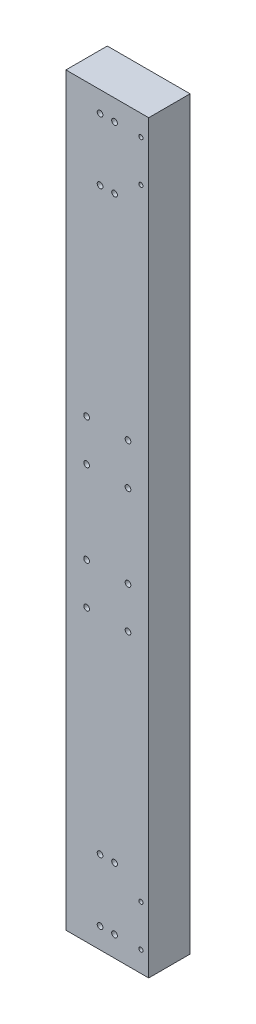
from build123d import *

# Parameters (mm, degrees)
SKETCH1_W           = 101.6
SKETCH1_H           = 50.8
BOSS_EXTRUDE1_DEPTH = 914.4
SKETCH3_R           = 3.4925
CUT_EXTRUDE1_DEPTH  = 50.8
SKETCH4_R           = 2.5527
CUT_EXTRUDE2_DEPTH  = 50.8
SKETCH5_R           = 3.4925
CUT_EXTRUDE3_DEPTH  = 50.8


with BuildPart() as part:
    # Sketch1 → Boss-Extrude1 (new body)
    with BuildSketch(Plane(origin=(0, 0, 0), x_dir=(1, 0, 0), z_dir=(0, 1, 0))):
        Rectangle(SKETCH1_W, SKETCH1_H)
    extrude(amount=BOSS_EXTRUDE1_DEPTH)

    # Sketch3 → Cut-Extrude1 (cut)
    with BuildSketch(Plane(origin=(0, 0, -25.4), x_dir=(-1, 0, 0), z_dir=(0, 0, -1))):
        with Locations((-8.89, 25.4)):
            Circle(SKETCH3_R)
        with Locations((8.89, 25.4)):
            Circle(SKETCH3_R)
        with Locations((8.89, 101.6)):
            Circle(SKETCH3_R)
        with Locations((-8.89, 101.6)):
            Circle(SKETCH3_R)
    cut_extrude1 = extrude(amount=-CUT_EXTRUDE1_DEPTH, mode=Mode.SUBTRACT)

    # Sketch4 → Cut-Extrude2 (cut)
    with BuildSketch(Plane(origin=(0, 0, -25.4), x_dir=(-1, 0, 0), z_dir=(0, 0, -1))):
        with Locations((-41.275, 76.2)):
            Circle(SKETCH4_R)
        with Locations((-41.275, 25.4)):
            Circle(SKETCH4_R)
    cut_extrude2 = extrude(amount=-CUT_EXTRUDE2_DEPTH, mode=Mode.SUBTRACT)

    # Mirror1: Cut-Extrude1, Cut-Extrude2 across plane
    add(cut_extrude1.mirror(Plane.ZX.offset(457.2)), mode=Mode.SUBTRACT)
    add(cut_extrude2.mirror(Plane.ZX.offset(457.2)), mode=Mode.SUBTRACT)

    # Sketch5 → Cut-Extrude3 (cut)
    with BuildSketch(Plane(origin=(0, 0, -25.4), x_dir=(-1, 0, 0), z_dir=(0, 0, -1))):
        with Locations((-25.4, 406.4)):
            Circle(SKETCH5_R)
        with Locations((25.4, 406.4)):
            Circle(SKETCH5_R)
        with Locations((25.4, 355.6)):
            Circle(SKETCH5_R)
        with Locations((-25.4, 355.6)):
            Circle(SKETCH5_R)
    cut_extrude3 = extrude(amount=-CUT_EXTRUDE3_DEPTH, mode=Mode.SUBTRACT)

    # Mirror2: Cut-Extrude3 across plane
    add(cut_extrude3.mirror(Plane.ZX.offset(457.2)), mode=Mode.SUBTRACT)


solid = part.part
